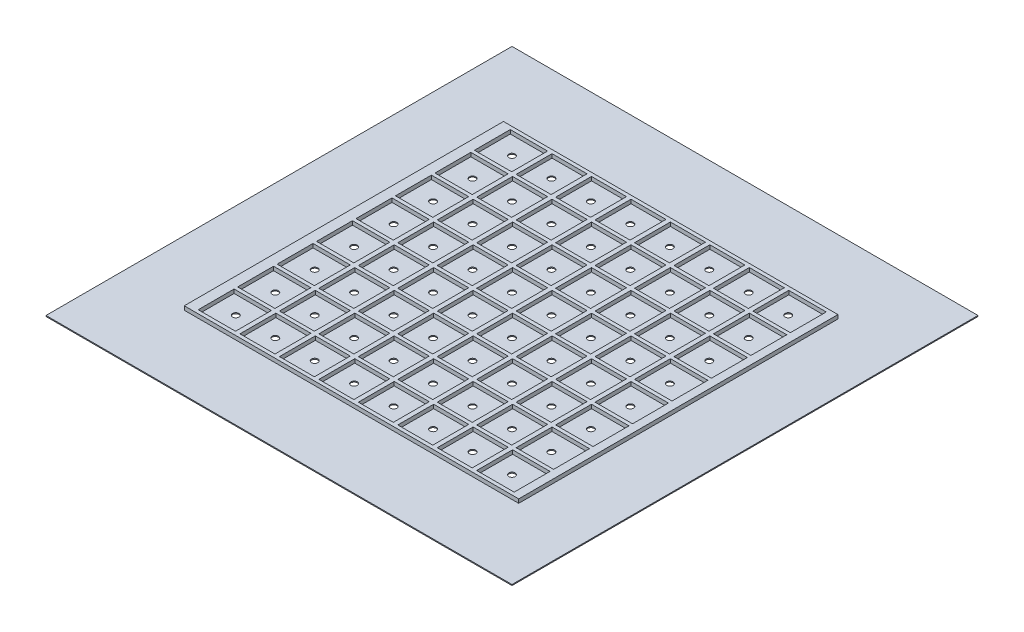
from build123d import *

# Parameters (mm, degrees)
SKETCH1_W            = 600
SKETCH1_H            = 600
BOSS_EXTRUDE1_DEPTH  = 1.242561379
SKETCH6_R            = 4.1
CUT_EXTRUDE1_DEPTH   = 425.265888281
LPATTERN1_COUNT      = 8
LPATTERN1_PITCH      = 50.8
LPATTERN1_COUNT_DIR2 = 8
LPATTERN1_PITCH_DIR2 = 50.8
SKETCH7_W            = 406.797285726
SKETCH7_H            = 4.6
BOSS_EXTRUDE4_DEPTH  = 5
LPATTERN3_COUNT      = 8
LPATTERN3_PITCH      = 50.8
LPATTERN3_COL_COUNT  = 2
LPATTERN3_COL_PITCH  = 50.8
SKETCH9_W            = 13.359654339
SKETCH9_H            = 411
SKETCH9_W_2          = 10.433350796
BOSS_EXTRUDE5_DEPTH  = 5
SKETCH10_W           = 5.777909053
SKETCH10_H           = 46.2
BOSS_EXTRUDE6_DEPTH  = 5
LPATTERN4_COUNT      = 7
LPATTERN4_PITCH      = 50.8
LPATTERN4_COUNT_DIR2 = 8
LPATTERN4_PITCH_DIR2 = 50.8


with BuildPart() as part:
    # Sketch1 → Boss-Extrude1 (new body)
    with BuildSketch(Plane(origin=(0, 0, 0), x_dir=(1, 0, 0), z_dir=(0, 1, 0))):
        Rectangle(SKETCH1_W, SKETCH1_H)
    extrude(amount=BOSS_EXTRUDE1_DEPTH)

    # Sketch6 → Cut-Extrude1 (cut, through all)
    with BuildSketch(Plane(origin=(0, 1.242561379, 0), x_dir=(1, 0, 0), z_dir=(0, 1, 0))):
        with Locations(Location((-178, 178, 0), (0, 0, 270))):
            Circle(SKETCH6_R)
    cut_extrude1 = extrude(amount=-CUT_EXTRUDE1_DEPTH, mode=Mode.SUBTRACT)

    # LPattern1: Cut-Extrude1 8 × 8
    with Locations(*[(i * LPATTERN1_PITCH, 0, j * LPATTERN1_PITCH_DIR2) for i in range(LPATTERN1_COUNT) for j in range(LPATTERN1_COUNT_DIR2) if (i, j) != (0, 0)]):
        add(cut_extrude1, mode=Mode.SUBTRACT)

    # Sketch7 → Boss-Extrude4 (add)
    with BuildSketch(Plane(origin=(0, 1.242561379, 0), x_dir=(1, 0, 0), z_dir=(0, 1, 0))):
        with Locations((0.009206197, 152.685017551)):
            Rectangle(SKETCH7_W, SKETCH7_H)
    boss_extrude4 = extrude(amount=BOSS_EXTRUDE4_DEPTH)

    # LPattern3: Boss-Extrude4 ×8
    with Locations(*[(0, 0, i * LPATTERN3_PITCH) for i in range(1, LPATTERN3_COUNT)]):
        add(boss_extrude4)

    # LPattern3 col: Boss-Extrude4 ×2
    with Locations(*[(0, 0, -i * LPATTERN3_COL_PITCH) for i in range(1, LPATTERN3_COL_COUNT)]):
        add(boss_extrude4)

    # Sketch9 → Boss-Extrude5 (add)
    with BuildSketch(Plane(origin=(0, 1.242561379, 0), x_dir=(1, 0, 0), z_dir=(0, 1, 0))):
        with Locations((-210.069263836, 0.285017551)):
            Rectangle(SKETCH9_W, SKETCH9_H)
        with Locations((208.624524458, 0.285017551)):
            Rectangle(SKETCH9_W_2, SKETCH9_H)
    extrude(amount=BOSS_EXTRUDE5_DEPTH)

    # Sketch10 → Boss-Extrude6 (add)
    with BuildSketch(Plane(origin=(0, 1.242561379, 0), x_dir=(1, 0, 0), z_dir=(0, 1, 0))):
        with Locations((-152.512409354, 178.085017551)):
            Rectangle(SKETCH10_W, SKETCH10_H)
    boss_extrude6 = extrude(amount=BOSS_EXTRUDE6_DEPTH)

    # LPattern4: Boss-Extrude6 7 × 8
    with Locations(*[(i * LPATTERN4_PITCH, 0, j * LPATTERN4_PITCH_DIR2) for i in range(LPATTERN4_COUNT) for j in range(LPATTERN4_COUNT_DIR2) if (i, j) != (0, 0)]):
        add(boss_extrude6)


solid = part.part
